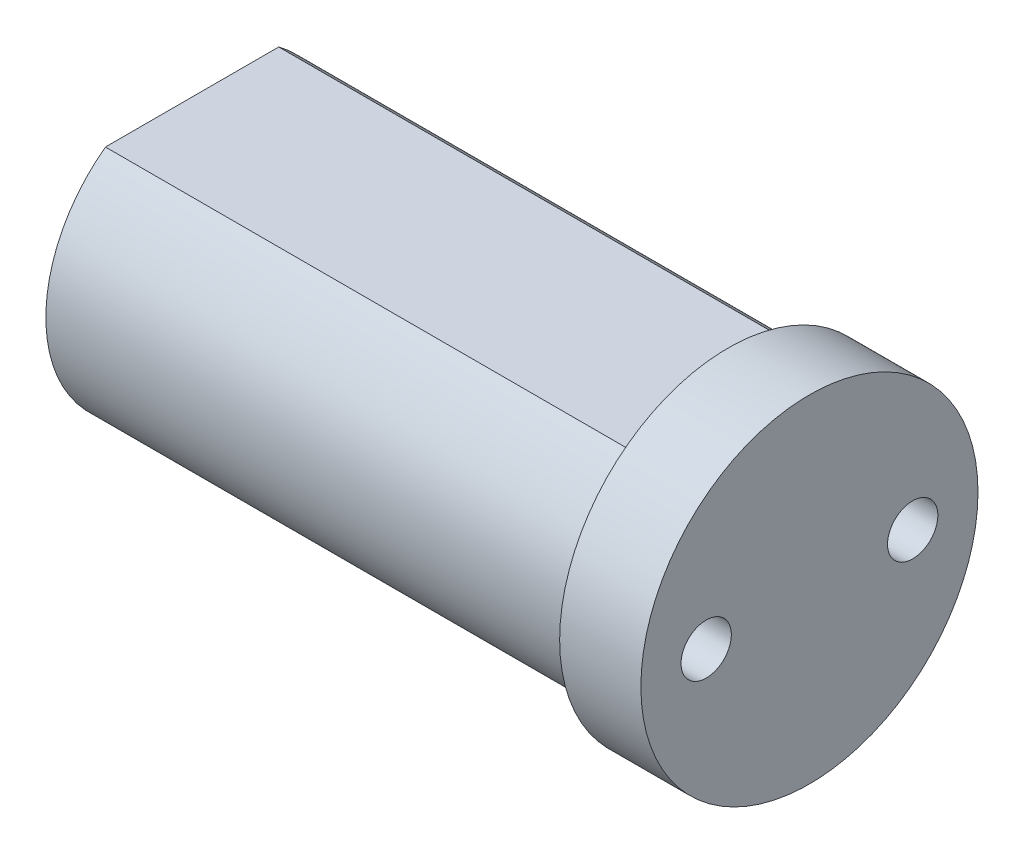
from build123d import *

# Parameters (mm, degrees)
SKETCH_1_R               = 4.15
EXTRUDE_1_DEPTH          = 2
EXTRUDE_2_DEPTH          = 13.2
CUT_EXTRUDE_1_DEPTH      = 15.445933684
CUT_EXTRUDE_1_DEPTH_BACK = 15.445933684
SKETCH_3_R               = 0.619261525


with BuildPart() as part:
    # Эскиз1 → Бобышка-Вытянуть1 (new body)
    with BuildSketch(Plane(origin=(0, 0, 0), x_dir=(0, 0, -1), z_dir=(1, 0, 0))):
        Circle(SKETCH_1_R)
    extrude(amount=EXTRUDE_1_DEPTH)

    # Эскиз2 → Бобышка-Вытянуть2 (add)
    with BuildSketch(Plane.ZY):
        with BuildLine():
            Line((2.133072901, 2.9), (-2.133072901, 2.9))
            ThreePointArc((-2.133072901, 2.9), (-3.6, 0), (-2.133072901, -2.9))
            Line((-2.133072901, -2.9), (2.133072901, -2.9))
            ThreePointArc((2.133072901, -2.9), (3.6, 0), (2.133072901, 2.9))
        make_face()
    extrude(amount=EXTRUDE_2_DEPTH)

    # Эскиз3 → Вырез-Вытянуть1 (cut, two sides: drawn at the far end of the back side and taken through both)
    with BuildSketch(Plane(origin=(0, 0, 0), x_dir=(0, 0, -1), z_dir=(1, 0, 0)).offset(-CUT_EXTRUDE_1_DEPTH_BACK)):
        with Locations((-2.541933221, 0)):
            Circle(SKETCH_3_R)
        with Locations(Location((2.541933221, 0, 0), (0, 0, 180))):
            Circle(SKETCH_3_R)
    extrude(amount=CUT_EXTRUDE_1_DEPTH + CUT_EXTRUDE_1_DEPTH_BACK, mode=Mode.SUBTRACT)


solid = part.part
